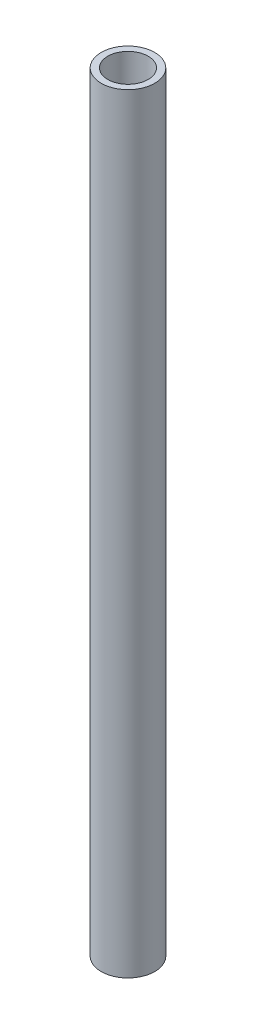
from build123d import *

# Parameters (mm, degrees)
SKETCH1_R           = 4.2037
SKETCH1_R_2         = 3.175
BOSS_EXTRUDE1_DEPTH = 120.904


with BuildPart() as part:
    # Sketch1 → Boss-Extrude1 (new body)
    with BuildSketch(Plane(origin=(0, 0, 0), x_dir=(1, 0, 0), z_dir=(0, 1, 0))):
        with Locations(Location((0, 0, 0), (0, 0, 270))):
            Circle(SKETCH1_R)
        with Locations(Location((0, 0, 0), (0, 0, 270))):
            Circle(SKETCH1_R_2, mode=Mode.SUBTRACT)
    extrude(amount=BOSS_EXTRUDE1_DEPTH)


solid = part.part
